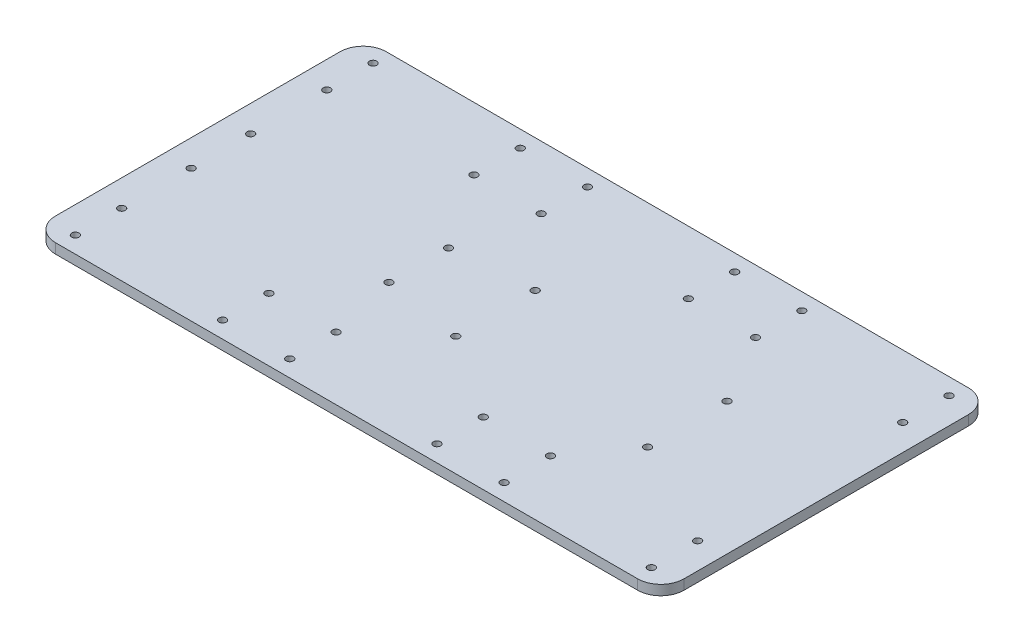
from build123d import *

# Parameters (mm, degrees)
SKETCH1_W                      = 190
SKETCH1_H                      = 100
BOSS_EXTRUDE1_DEPTH            = 3
TAP_DRILL_FOR_M2_5X0_45_TAP1_D = 2.2
FILLET1_R                      = 7


with BuildPart() as part:
    # Sketch1 → Boss-Extrude1 (new body)
    with BuildSketch(Plane(origin=(0, 0, 0), x_dir=(1, 0, 0), z_dir=(0, 1, 0))):
        with Locations((95, 50)):
            Rectangle(SKETCH1_W, SKETCH1_H)
    extrude(amount=BOSS_EXTRUDE1_DEPTH)

    # Tap Drill for M2.5x0.45 Tap1 (through all)
    with Locations(Plane(origin=(0, 3, 0), x_dir=(1, 0, 0), z_dir=(0, 1, 0))):
        with Locations((8, 95), (52.5, 95), (52.5, 81), (8, 81), (52.5, 19), (52.5, 5), (8, 19), (8, 5), (72.811, 95), (117.311, 95), (117.311, 81), (72.811, 81), (137.622, 95), (182.122, 95), (182.122, 81), (137.622, 81), (72.811, 19), (117.311, 19), (137.622, 19), (182.122, 19), (182.122, 5), (137.622, 5), (117.311, 5), (72.811, 5), (8, 58), (8, 40), (67.78, 58), (67.78, 40), (92, 60), (92, 36), (150, 36), (150, 60)):
            Hole(TAP_DRILL_FOR_M2_5X0_45_TAP1_D / 2)

    # Fillet1
    fillet1_edges = [part.edges().sort_by_distance(p)[0] for p in [
        (0, 1.5, -100),
        (190, 1.5, -100),
        (190, 1.5, 0),
        (0, 1.5, 0),
    ]]
    fillet(fillet1_edges, radius=FILLET1_R)


solid = part.part
